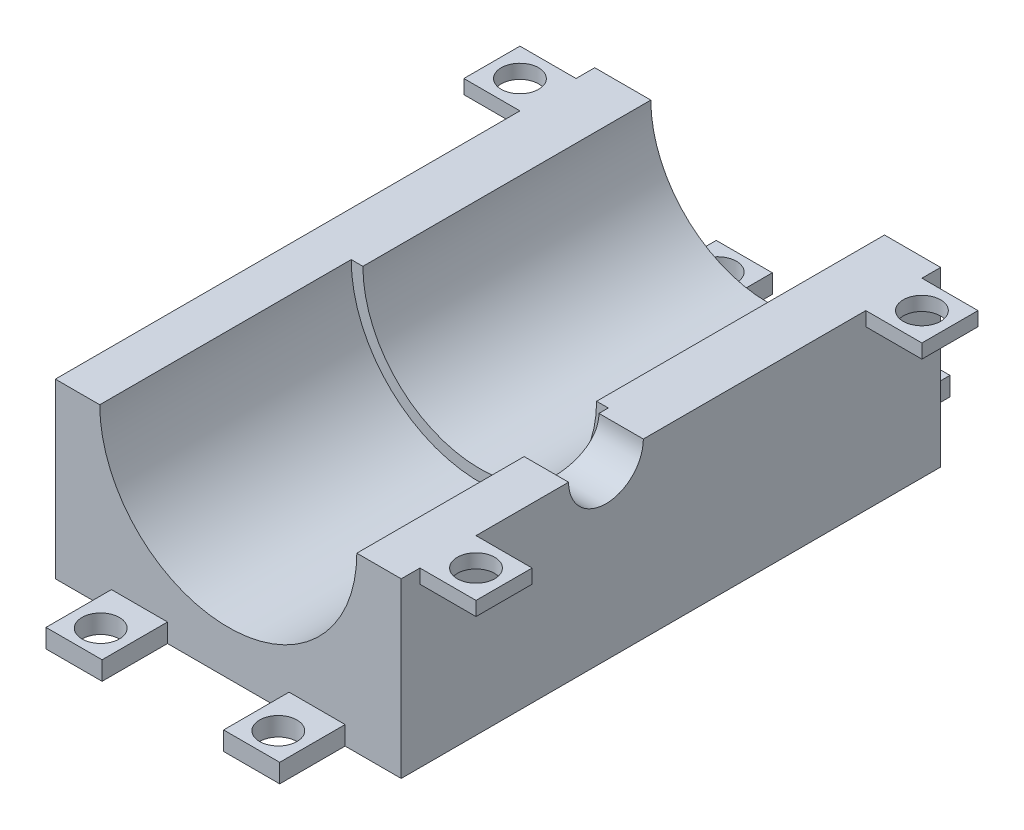
from build123d import *

# Parameters (mm, degrees)
EXTRUDE_1_DEPTH     = 57.7
EXTRUDE_2_DEPTH     = 30.8
SKETCH_5_R          = 4
CUT_EXTRUDE_1_DEPTH = 15
SKETCH_7_W          = 6
SKETCH_7_H          = 7
SKETCH_7_R          = 2
EXTRUDE_3_DEPTH     = 2
SKETCH_8_W          = 6
SKETCH_8_H          = 1.5
EXTRUDE_4_DEPTH     = 6
EXTRUDE_START       = -37
SKETCH_8_3_W        = 6
SKETCH_8_3_H        = 1.5
EXTRUDE_5_DEPTH     = 6
SKETCH_9_R          = 2
CUT_EXTRUDE_2_DEPTH = 6
CUT_EXTRUDE_START   = -26.9
CUT_EXTRUDE_3_DEPTH = 26.9
CUT_EXTRUDE_4_DEPTH = 49.696406438
SKETCH_12_W         = 6
SKETCH_12_H         = 6
CUT_EXTRUDE_5_DEPTH = 10


with BuildPart() as part:
    # 스케치1 → 보스-돌출1 (new body)
    with BuildSketch(Plane.XY):
        with BuildLine():
            Line((-13.5, 0), (-18.5, 0))
            Line((-18.5, 0), (-18.5, -18.5))
            Line((-18.5, -18.5), (18.5, -18.5))
            Line((18.5, -18.5), (18.5, 0))
            Line((18.5, 0), (13.5, 0))
            ThreePointArc((13.5, 0), (0, -13.5), (-13.5, 0))
        make_face()
    extrude(amount=-EXTRUDE_1_DEPTH)

    # 스케치3 → 보스-돌출2 (add)
    with BuildSketch(Plane.XY.offset(-26.9)):
        with BuildLine():
            Line((-13.5, 0), (-11.5, 0))
            ThreePointArc((-11.5, 0), (0, -11.5), (11.5, 0))
            Line((11.5, 0), (13.5, 0))
            ThreePointArc((13.5, 0), (0, -13.5), (-13.5, 0))
        make_face()
    extrude(amount=-EXTRUDE_2_DEPTH)

    # 스케치5 → 컷-돌출1 (cut)
    with BuildSketch(Plane.ZY.offset(-18.5)):
        with Locations((-21.9, 0)):
            Circle(SKETCH_5_R)
    extrude(amount=CUT_EXTRUDE_1_DEPTH, mode=Mode.SUBTRACT)

    # 스케치7 → 보스-돌출3 (add)
    # profile 1 of 2: a face of its own
    with BuildSketch(Plane.XZ.offset(18.5)):
        with Locations((9.5, 3.5)):
            Rectangle(SKETCH_7_W, SKETCH_7_H)
        with Locations(Location((9.5, 4.15, 0), (0, 0, 270))):
            Circle(SKETCH_7_R, mode=Mode.SUBTRACT)
    # profile 2 of 2: a face of its own
    with BuildSketch(Plane.XZ.offset(18.5)):
        with Locations((-9.5, 3.5)):
            Rectangle(SKETCH_7_W, SKETCH_7_H)
        with Locations(Location((-9.5, 4.15, 0), (0, 0, 270))):
            Circle(SKETCH_7_R, mode=Mode.SUBTRACT)
    extrude_3 = extrude(amount=-EXTRUDE_3_DEPTH)

    # 대칭 복사1: 보스-돌출3 across plane
    add(extrude_3.mirror(Plane.XY.offset(-28.85)))

    # 스케치8 → 보스-돌출4 (add)
    with BuildSketch(Plane.ZY.offset(18.5)):
        with Locations((-5, -0.75)):
            Rectangle(SKETCH_8_W, SKETCH_8_H)
        with Locations((-52.7, -0.75)):
            Rectangle(SKETCH_8_W, SKETCH_8_H)
    extrude(amount=EXTRUDE_4_DEPTH)

    # 스케치8<3> → 보스-돌출5 (add)
    with BuildSketch(Plane.ZY.offset(18.5).offset(EXTRUDE_START)):
        with Locations((-5, -0.75)):
            Rectangle(SKETCH_8_3_W, SKETCH_8_3_H)
        with Locations((-52.7, -0.75)):
            Rectangle(SKETCH_8_3_W, SKETCH_8_3_H)
    extrude(amount=-EXTRUDE_5_DEPTH)

    # 스케치9 → 컷-돌출2 (cut)
    with BuildSketch(Plane(origin=(0, 0, 0), x_dir=(1, 0, 0), z_dir=(0, 1, 0))):
        with Locations(Location((-21.5, 52.7, 0), (0, 0, 180))):
            Circle(SKETCH_9_R)
        with Locations(Location((-21.5, 5, 0), (0, 0, 180))):
            Circle(SKETCH_9_R)
        with Locations(Location((21.5, 5, 0), (0, 0, 270))):
            Circle(SKETCH_9_R)
        with Locations(Location((21.5, 52.7, 0), (0, 0, 90))):
            Circle(SKETCH_9_R)
    extrude(amount=-CUT_EXTRUDE_2_DEPTH, mode=Mode.SUBTRACT)

    # 스케치10 → 컷-돌출3 (cut)
    with BuildSketch(Plane.XY.offset(CUT_EXTRUDE_START)):
        with BuildLine():
            Line((-13.5, 0), (-13.75, 0))
            ThreePointArc((-13.75, 0), (0, -13.75), (13.75, 0))
            Line((13.75, 0), (13.5, 0))
            ThreePointArc((13.5, 0), (0, -13.5), (-13.5, 0))
        make_face()
    extrude(amount=CUT_EXTRUDE_3_DEPTH, mode=Mode.SUBTRACT)

    # 스케치11 → 컷-돌출4 (cut, through all)
    with BuildSketch(Plane.XY.offset(-26.9)):
        with BuildLine():
            ThreePointArc((11.5, 0), (0, -11.5), (-11.5, 0))
            Line((-11.5, 0), (-12.5, 0))
            ThreePointArc((-12.5, 0), (0, -12.5), (12.5, 0))
            Line((12.5, 0), (11.5, 0))
        make_face()
    extrude(amount=-CUT_EXTRUDE_4_DEPTH, mode=Mode.SUBTRACT)

    # 스케치12 → 컷-돌출5 (cut)
    with BuildSketch(Plane(origin=(0, 0, 0), x_dir=(1, 0, 0), z_dir=(0, 1, 0))):
        with Locations((-21.5, 5)):
            Rectangle(SKETCH_12_W, SKETCH_12_H)
    extrude(amount=-CUT_EXTRUDE_5_DEPTH, mode=Mode.SUBTRACT)


solid = part.part
